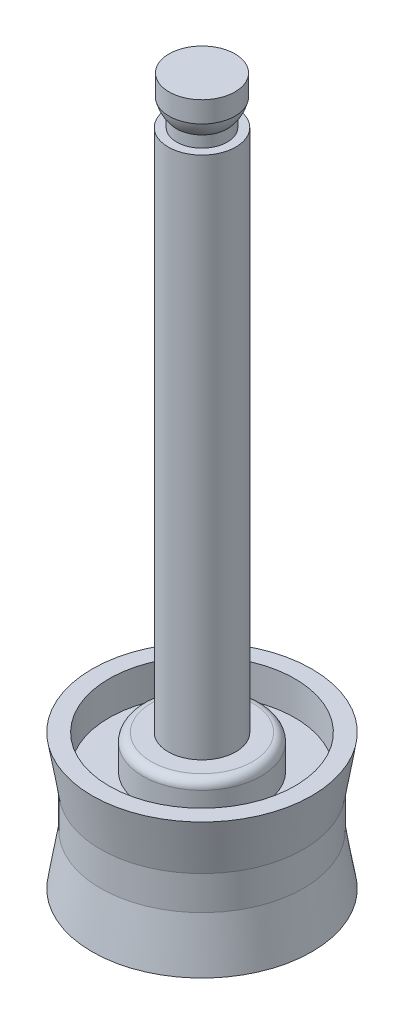
from build123d import *

# Parameters (mm, degrees)
SKETCH_1_R          = 6.5
EXTRUDE_1_DEPTH     = 8
SKETCH_2_R          = 2
EXTRUDE_2_DEPTH     = 31
SKETCH_6_R          = 5.5
SKETCH_6_R_2        = 3.5
CUT_EXTRUDE_1_DEPTH = 2
CUT_EXTRUDE_START   = -2
SKETCH_7_R          = 5.5
SKETCH_7_R_2        = 3.5
CUT_EXTRUDE_2_DEPTH = 2
FILLET_2_R          = 0.5


with BuildPart() as part:
    # 草图1 → 凸台-拉伸1 (new body)
    with BuildSketch(Plane(origin=(0, 0, 0), x_dir=(1, 0, 0), z_dir=(0, 1, 0))):
        with Locations(Location((0, 0, 0), (0, 0, 270))):
            Circle(SKETCH_1_R)
    extrude(amount=EXTRUDE_1_DEPTH)

    # 草图2 → 凸台-拉伸2 (add)
    with BuildSketch(Plane(origin=(0, 8, 0), x_dir=(1, 0, 0), z_dir=(0, 1, 0))):
        with Locations(Location((0, 0, 0), (0, 0, 270))):
            Circle(SKETCH_2_R)
    extrude(amount=EXTRUDE_2_DEPTH)

    # 草图4 → 旋转1 (revolve)
    with BuildSketch(Plane.XY):
        with BuildLine():
            Line((0, 39), (0, 41))
            Line((0, 41), (0, 41.8))
            Line((0, 41.8), (1.95, 41.8))
            Line((1.95, 41.8), (1.95, 40.555590279))
            ThreePointArc((1.95, 40.555590279), (1.780042303, 40.088161527), (1.5, 39.677124344))
            Line((1.5, 39.677124344), (1.5, 39))
            Line((1.5, 39), (0, 39))
        make_face()
    revolve(axis=Axis((0, 39, 0), (0, 1, 0)))

    # 草图5 → 切除-旋转1 (revolve, cut)
    with BuildSketch(Plane.XY, mode=Mode.PRIVATE) as cut_revolve_1_sk:
        Polygon((-6.5, 8), (-6.5, 5), (-6.5, 3), (-6.5, 0), (-6, 3), (-6, 5), align=None)
    revolve(cut_revolve_1_sk.sketch.rotate(Axis((0, 0, 0), (0, 1, 0)), 270), axis=Axis((0, 0, 0), (0, 1, 0)), mode=Mode.SUBTRACT)

    # 草图6 → 切除-拉伸1 (cut)
    with BuildSketch(Plane.XZ):
        with Locations(Location((0, 0, 0), (0, 0, 270))):
            Circle(SKETCH_6_R)
        with Locations(Location((0, 0, 0), (0, 0, 270))):
            Circle(SKETCH_6_R_2, mode=Mode.SUBTRACT)
    extrude(amount=-CUT_EXTRUDE_1_DEPTH, mode=Mode.SUBTRACT)

    # 草图7 → 切除-拉伸2 (cut)
    with BuildSketch(Plane(origin=(0, 8, 0), x_dir=(1, 0, 0), z_dir=(0, 1, 0)).offset(CUT_EXTRUDE_START)):
        with Locations(Location((0, 0, 0), (0, 0, 90))):
            Circle(SKETCH_7_R)
        with Locations(Location((0, 0, 0), (0, 0, 90))):
            Circle(SKETCH_7_R_2, mode=Mode.SUBTRACT)
    extrude(amount=CUT_EXTRUDE_2_DEPTH, mode=Mode.SUBTRACT)

    # 圆角2
    fillet_2_edges = [part.edges().sort_by_distance(p)[0] for p in [
        (0, 0, 3.5),
        (0, 8, 3.5),
    ]]
    fillet(fillet_2_edges, radius=FILLET_2_R)


solid = part.part
